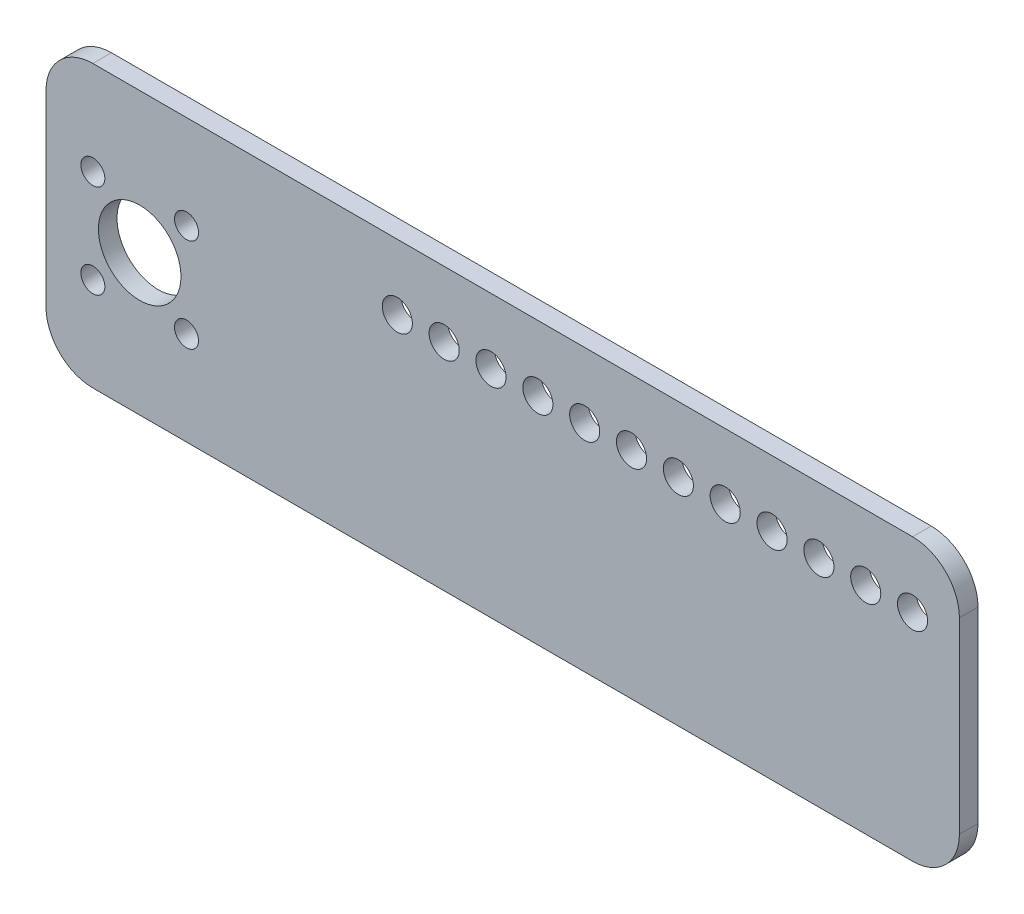
from build123d import *

# Parameters (mm, degrees)
SKETCH2_W           = 156
SKETCH2_H           = 48
SKETCH2_R           = 2.05
SKETCH2_R_2         = 7.05
BOSS_EXTRUDE2_DEPTH = 3.175
FILLET1_R           = 8
SKETCH3_R           = 2.571717643
CUT_EXTRUDE1_DEPTH  = 10


with BuildPart() as part:
    # Sketch2 → Boss-Extrude2 (new body)
    with BuildSketch(Plane.XY):
        Rectangle(SKETCH2_W, SKETCH2_H)
        with Locations((-70, 8)):
            Circle(SKETCH2_R, mode=Mode.SUBTRACT)
        with Locations((-54, 8)):
            Circle(SKETCH2_R, mode=Mode.SUBTRACT)
        with Locations((-54, -8)):
            Circle(SKETCH2_R, mode=Mode.SUBTRACT)
        with Locations((-70, -8)):
            Circle(SKETCH2_R, mode=Mode.SUBTRACT)
        with Locations((-62, 0)):
            Circle(SKETCH2_R_2, mode=Mode.SUBTRACT)
    extrude(amount=BOSS_EXTRUDE2_DEPTH)

    # Fillet1
    fillet1_edges = [part.edges().sort_by_distance(p)[0] for p in [
        (78, 24, 1.5875),
        (78, -24, 1.5875),
        (-78, -24, 1.5875),
        (-78, 24, 1.5875),
    ]]
    fillet(fillet1_edges, radius=FILLET1_R)

    # Sketch3 → Cut-Extrude1 (cut)
    with BuildSketch(Plane.XY.offset(3.175)):
        with Locations((70, 12.825)):
            Circle(SKETCH3_R)
        with Locations((62, 12.825)):
            Circle(SKETCH3_R)
        with Locations((54, 12.825)):
            Circle(SKETCH3_R)
        with Locations((46, 12.825)):
            Circle(SKETCH3_R)
        with Locations((38, 12.825)):
            Circle(SKETCH3_R)
        with Locations((30, 12.825)):
            Circle(SKETCH3_R)
        with Locations((22, 12.825)):
            Circle(SKETCH3_R)
        with Locations((14, 12.825)):
            Circle(SKETCH3_R)
        with Locations((6, 12.825)):
            Circle(SKETCH3_R)
        with Locations((-2, 12.825)):
            Circle(SKETCH3_R)
        with Locations((-10, 12.825)):
            Circle(SKETCH3_R)
        with Locations((-18, 12.825)):
            Circle(SKETCH3_R)
    extrude(amount=-CUT_EXTRUDE1_DEPTH, mode=Mode.SUBTRACT)


solid = part.part
